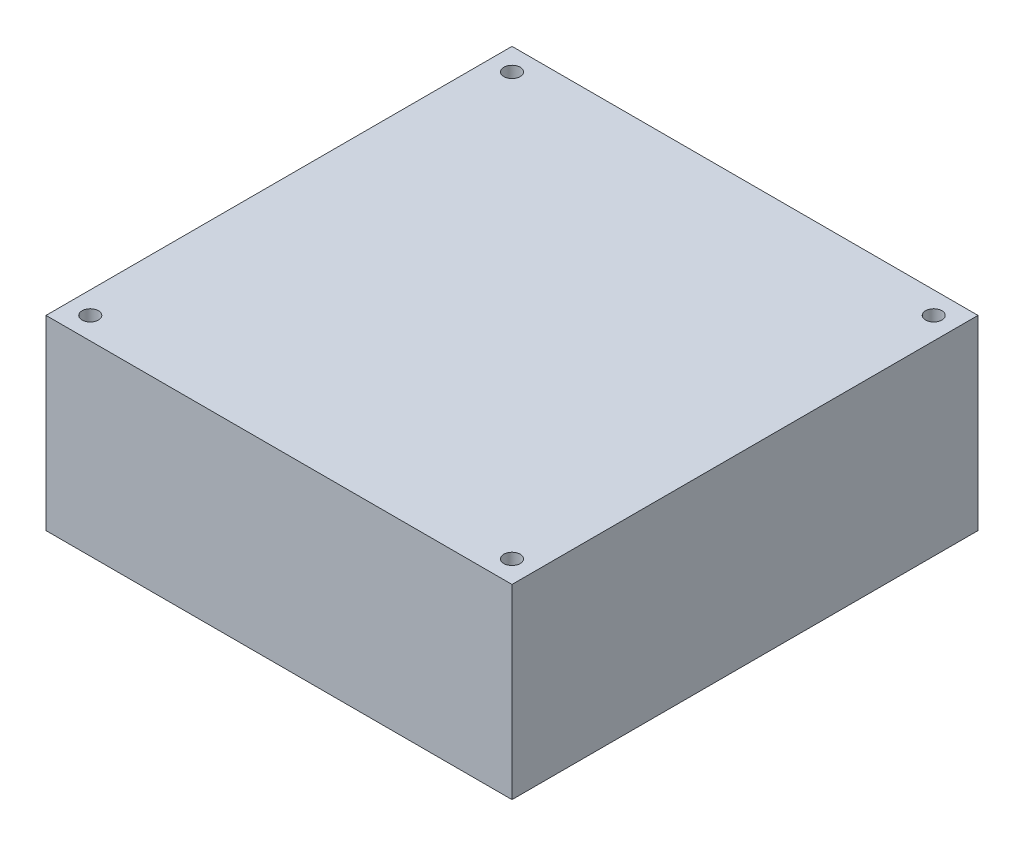
from build123d import *

# Parameters (mm, degrees)
ESBO_O1_W                = 100
ESBO_O1_H                = 100
ESBO_O1_R                = 1.75
RESSALTO_EXTRUS_O1_DEPTH = 40


with BuildPart() as part:
    # Esboço1 → Ressalto-extrusão1 (new body)
    with BuildSketch(Plane(origin=(0, 40, 0), x_dir=(1, 0, 0), z_dir=(0, 1, 0))):
        with Locations((50, 50)):
            Rectangle(ESBO_O1_W, ESBO_O1_H)
        with Locations(Location((4.75, 95.25, 0), (0, 0, 90))):
            Circle(ESBO_O1_R, mode=Mode.SUBTRACT)
        with Locations(Location((95.25, 95.25, 0), (0, 0, 90))):
            Circle(ESBO_O1_R, mode=Mode.SUBTRACT)
        with Locations(Location((95.25, 4.75, 0), (0, 0, 90))):
            Circle(ESBO_O1_R, mode=Mode.SUBTRACT)
        with Locations(Location((4.75, 4.75, 0), (0, 0, 90))):
            Circle(ESBO_O1_R, mode=Mode.SUBTRACT)
    extrude(amount=-RESSALTO_EXTRUS_O1_DEPTH)


solid = part.part
